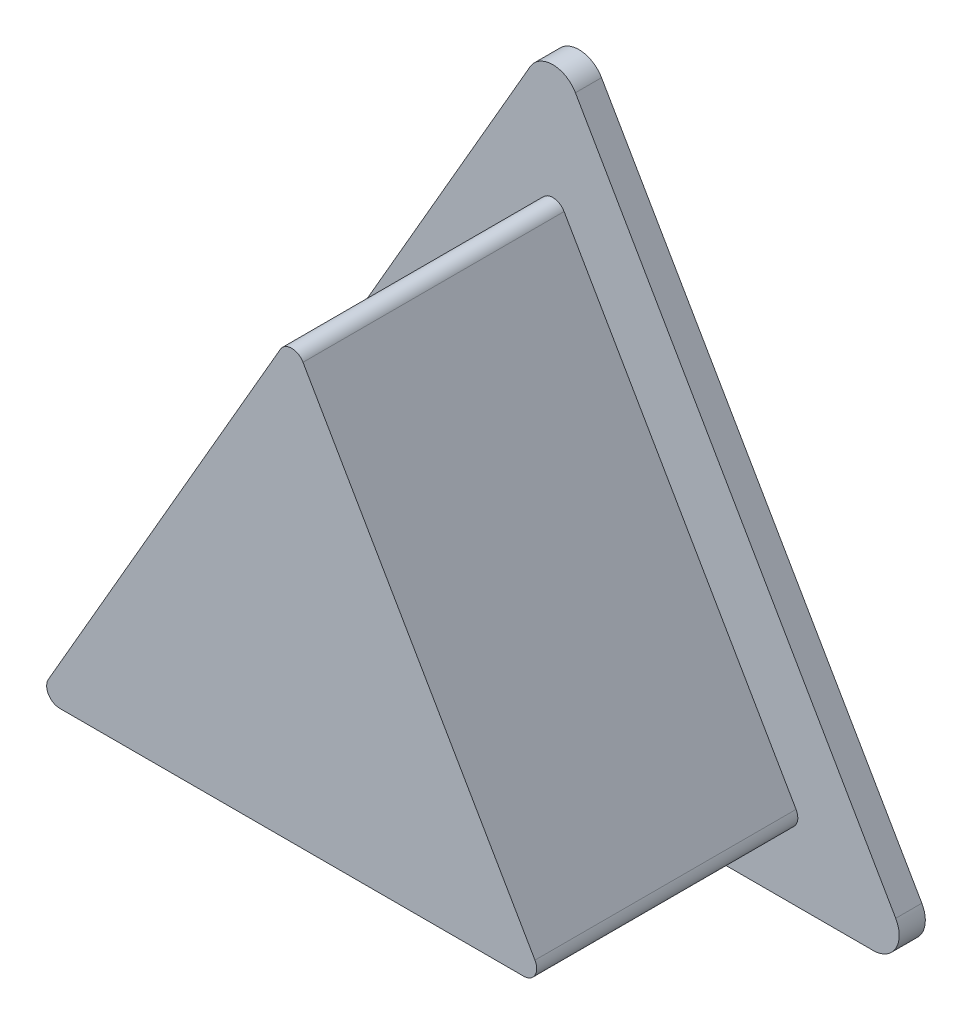
from build123d import *

# Parameters (mm, degrees)
BOSS_EXTRUDE1_DEPTH = 5
BOSS_EXTRUDE2_DEPTH = 0.5
FILLET1_R           = 0.5
FILLET2_R           = 0.25
SKETCH3_R           = 1.75
CUT_EXTRUDE1_DEPTH  = 0.75


with BuildPart() as part:
    # Sketch1 → Boss-Extrude1 (new body)
    with BuildSketch(Plane.XY):
        Polygon((0, 5.629165125), (-4.875, -2.814582562), (4.875, -2.814582562), align=None)
    extrude(amount=BOSS_EXTRUDE1_DEPTH)

    # Sketch2 → Boss-Extrude2 (add)
    with BuildSketch(Plane(origin=(0, 0, 0), x_dir=(-1, 0, 0), z_dir=(0, 0, -1))):
        Polygon((0, 8.082903769), (-7, -4.041451884), (7, -4.041451884), align=None)
    extrude(amount=BOSS_EXTRUDE2_DEPTH)

    # Fillet1
    fillet1_edges = [part.edges().sort_by_distance(p)[0] for p in [
        (-7, -4.041451884, -0.25),
        (0, 8.082903769, -0.25),
        (7, -4.041451884, -0.25),
    ]]
    fillet(fillet1_edges, radius=FILLET1_R)

    # Fillet2
    fillet2_edges = [part.edges().sort_by_distance(p)[0] for p in [
        (4.875, -2.814582562, 2.5),
        (-4.875, -2.814582562, 2.5),
        (0, 5.629165125, 2.5),
    ]]
    fillet(fillet2_edges, radius=FILLET2_R)

    # Sketch3 → Cut-Extrude1 (cut)
    with BuildSketch(Plane(origin=(0, 0, -0.5), x_dir=(-1, 0, 0), z_dir=(0, 0, -1))):
        Circle(SKETCH3_R)
    extrude(amount=-CUT_EXTRUDE1_DEPTH, mode=Mode.SUBTRACT)


solid = part.part
